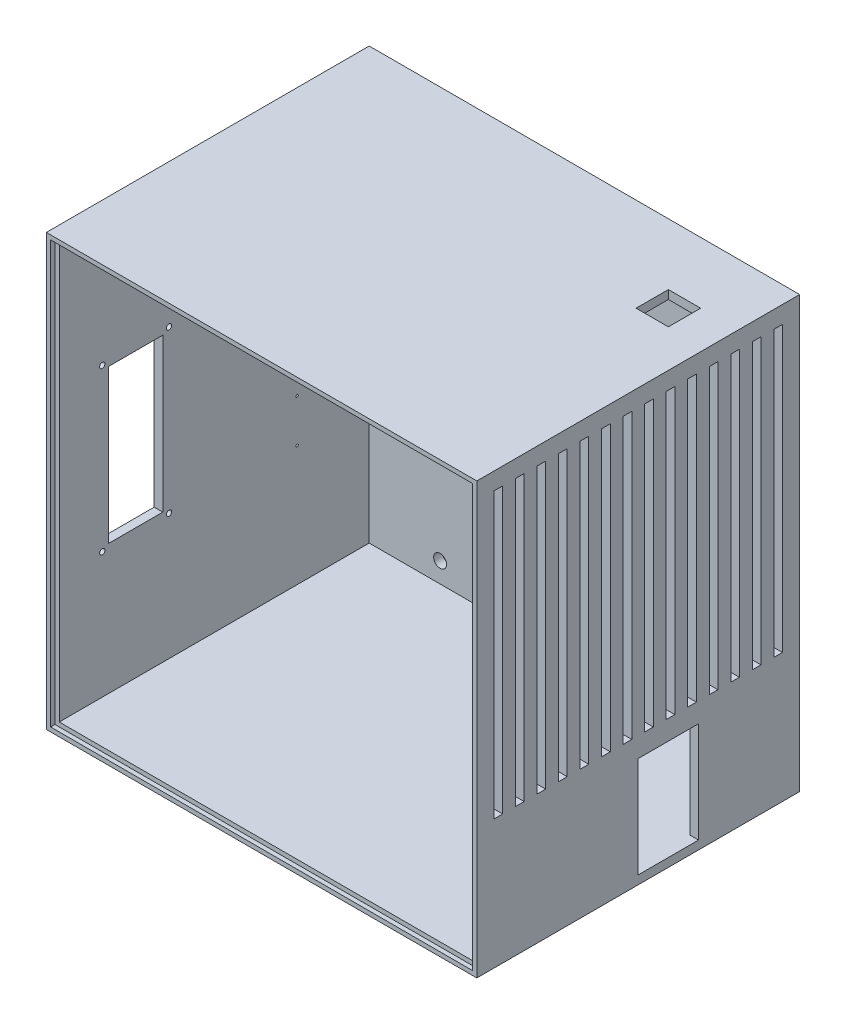
from build123d import *

# Parameters (mm, degrees)
SKETCH4_W                = 200
SKETCH4_H                = 200
BOSS_EXTRUDE1_DEPTH      = 150
SKETCH6_W                = 196
SKETCH6_H                = 196
CUT_EXTRUDE1_DEPTH       = 2
SKETCH7_W                = 192
SKETCH7_H                = 192
CUT_EXTRUDE2_DEPTH       = 92
SKETCH9_W                = 28
SKETCH9_H                = 46.8
INLET_DEPTH              = 4
SKETCH13_W               = 4
SKETCH13_H               = 132
AIRFLOW_DEPTH            = 4
SKETCH11_W               = 25.2
SKETCH11_H               = 71.2
CUT_EXTRUDE5_DEPTH       = 4
SKETCH11_4_R             = 1.25
LCD_MOUNTING_DEPTH       = 4
SKETCH12_R               = 0.55
SKETCH12_R_2             = 1
POST_KNOB_MOUNTING_DEPTH = 4
SKETCH14_R               = 3
CUT_EXTRUDE10_DEPTH      = 56
SKETCH17_W               = 192
SKETCH17_H               = 192
CUT_EXTRUDE11_DEPTH      = 52
SKETCH18_R               = 1.6
CUT_EXTRUDE12_DEPTH      = 4
SKETCH20_W               = 15
SKETCH20_H               = 15
CUT_EXTRUDE13_DEPTH      = 4


with BuildPart() as part:
    # Sketch4 → Boss-Extrude1 (new body)
    with BuildSketch(Plane.XY):
        with Locations((100, 100)):
            Rectangle(SKETCH4_W, SKETCH4_H)
    extrude(amount=BOSS_EXTRUDE1_DEPTH)

    # Sketch6 → Cut-Extrude1 (cut)
    with BuildSketch(Plane.XY.offset(150)):
        with Locations((100, 100)):
            Rectangle(SKETCH6_W, SKETCH6_H)
    extrude(amount=-CUT_EXTRUDE1_DEPTH, mode=Mode.SUBTRACT)

    # Sketch7 → Cut-Extrude2 (cut)
    with BuildSketch(Plane.XY.offset(148)):
        with Locations((100, 100)):
            Rectangle(SKETCH7_W, SKETCH7_H)
    extrude(amount=-CUT_EXTRUDE2_DEPTH, mode=Mode.SUBTRACT)

    # Sketch9 → Inlet (cut)
    with BuildSketch(Plane(origin=(200, 0, 0), x_dir=(0, 0, -1), z_dir=(1, 0, 0))):
        with Locations((-61, 27.4)):
            Rectangle(SKETCH9_W, SKETCH9_H)
    extrude(amount=-INLET_DEPTH, mode=Mode.SUBTRACT)

    # Sketch13 → Airflow (cut)
    with BuildSketch(Plane(origin=(200, 0, 0), x_dir=(0, 0, -1), z_dir=(1, 0, 0))):
        with Locations((-10, 126)):
            Rectangle(SKETCH13_W, SKETCH13_H)
        with Locations((-20, 126)):
            Rectangle(SKETCH13_W, SKETCH13_H)
        with Locations((-30, 126)):
            Rectangle(SKETCH13_W, SKETCH13_H)
        with Locations((-40, 126)):
            Rectangle(SKETCH13_W, SKETCH13_H)
        with Locations((-50, 126)):
            Rectangle(SKETCH13_W, SKETCH13_H)
        with Locations((-60, 126)):
            Rectangle(SKETCH13_W, SKETCH13_H)
        with Locations((-70, 126)):
            Rectangle(SKETCH13_W, SKETCH13_H)
        with Locations((-80, 126)):
            Rectangle(SKETCH13_W, SKETCH13_H)
        with Locations((-90, 126)):
            Rectangle(SKETCH13_W, SKETCH13_H)
        with Locations((-100, 126)):
            Rectangle(SKETCH13_W, SKETCH13_H)
        with Locations((-110, 126)):
            Rectangle(SKETCH13_W, SKETCH13_H)
        with Locations((-120, 126)):
            Rectangle(SKETCH13_W, SKETCH13_H)
        with Locations((-130, 126)):
            Rectangle(SKETCH13_W, SKETCH13_H)
        with Locations((-140, 126)):
            Rectangle(SKETCH13_W, SKETCH13_H)
    extrude(amount=-AIRFLOW_DEPTH, mode=Mode.SUBTRACT)

    # Sketch11 → Cut-Extrude5 (cut)
    with BuildSketch(Plane.ZY):
        with Locations((112.5, 100)):
            Rectangle(SKETCH11_W, SKETCH11_H)
    extrude(amount=-CUT_EXTRUDE5_DEPTH, mode=Mode.SUBTRACT)

    # Sketch11<4> → LCD/Mounting (cut)
    with BuildSketch(Plane.ZY):
        with Locations((128, 137.5)):
            Circle(SKETCH11_4_R)
        with Locations((97, 137.5)):
            Circle(SKETCH11_4_R)
        with Locations((97, 62.5)):
            Circle(SKETCH11_4_R)
        with Locations((128, 62.5)):
            Circle(SKETCH11_4_R)
    extrude(amount=-LCD_MOUNTING_DEPTH, mode=Mode.SUBTRACT)

    # Sketch12 → Post/Knob Mounting (cut)
    with BuildSketch(Plane.ZY):
        with Locations((37.5, 100)):
            Circle(SKETCH12_R)
        with Locations((37.5, 80)):
            Circle(SKETCH12_R)
        with Locations((37.5, 60)):
            Circle(SKETCH12_R)
        with Locations((37.5, 148)):
            Circle(SKETCH12_R_2)
    extrude(amount=-POST_KNOB_MOUNTING_DEPTH, mode=Mode.SUBTRACT)

    # Sketch14 → Cut-Extrude10 (cut)
    with BuildSketch(Plane.XY.offset(56)):
        with Locations((36.935, 13.318)):
            Circle(SKETCH14_R)
        with Locations((171.555, 13.318)):
            Circle(SKETCH14_R)
        with Locations((171.555, 104.25)):
            Circle(SKETCH14_R)
        with Locations((37.506, 103.996)):
            Circle(SKETCH14_R)
    extrude(amount=-CUT_EXTRUDE10_DEPTH, mode=Mode.SUBTRACT)

    # Sketch17 → Cut-Extrude11 (cut)
    with BuildSketch(Plane.XY.offset(56)):
        with Locations((100, 100)):
            Rectangle(SKETCH17_W, SKETCH17_H)
    extrude(amount=-CUT_EXTRUDE11_DEPTH, mode=Mode.SUBTRACT)

    # Sketch18 → Cut-Extrude12 (cut)
    with BuildSketch(Plane.XY.offset(4)):
        with Locations((126.8, 188.46)):
            Circle(SKETCH18_R)
        with Locations((126.8, 142.74)):
            Circle(SKETCH18_R)
        with Locations((76, 157.98)):
            Circle(SKETCH18_R)
        with Locations((76, 185.92)):
            Circle(SKETCH18_R)
    extrude(amount=-CUT_EXTRUDE12_DEPTH, mode=Mode.SUBTRACT)

    # Sketch20 → Cut-Extrude13 (cut)
    with BuildSketch(Plane(origin=(0, 200, 0), x_dir=(1, 0, 0), z_dir=(0, 1, 0))):
        with Locations((175, -36)):
            Rectangle(SKETCH20_W, SKETCH20_H)
    extrude(amount=-CUT_EXTRUDE13_DEPTH, mode=Mode.SUBTRACT)


solid = part.part
